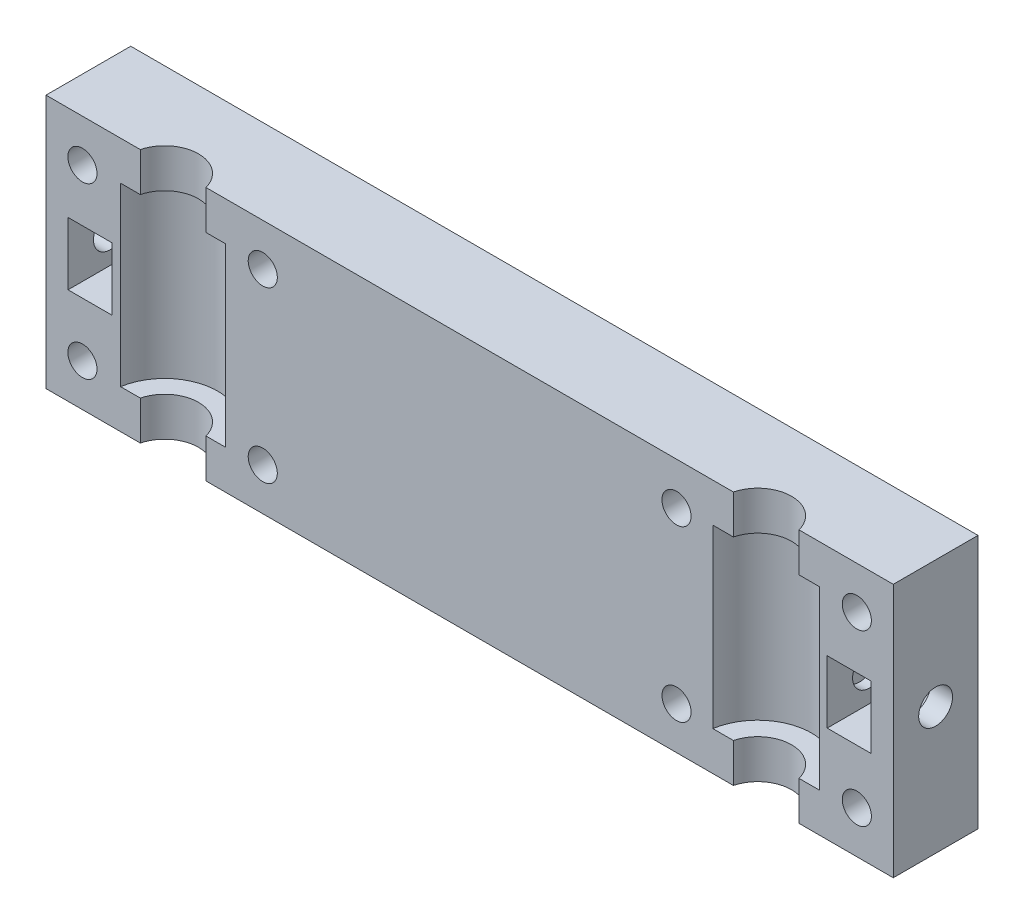
from build123d import *

# Parameters (mm, degrees)
SKETCH1_W                                      = 127
SKETCH1_H                                      = 12.7
BOSS_EXTRUDE1_DEPTH                            = 38.1
SKETCH3_R                                      = 4.445
CUT_EXTRUDE3_DEPTH                             = 2.54
CUT_EXTRUDE4_DEPTH                             = 13.208
CUT_EXTRUDE4_DEPTH_BACK                        = 13.208
SKETCH2_R                                      = 7.9756
SKETCH2_R_2                                    = 8.1026
SKETCH6_R                                      = 5.08
CUT_EXTRUDE5_DEPTH                             = 38.1
F_11_64_0_17188_DIAMETER_HOLE1_D               = 4.365752
F_11_64_0_17188_DIAMETER_HOLE1_DEPTH           = 25.4
F_11_64_0_17188_DIAMETER_HOLE1_TIP             = 1.311604225
F_11_64_0_17188_DIAMETER_HOLE1_ON_FACE_2_D     = 4.365752
F_11_64_0_17188_DIAMETER_HOLE1_ON_FACE_2_DEPTH = 25.4
F_11_64_0_17188_DIAMETER_HOLE1_ON_FACE_2_TIP   = 1.311604225
SKETCH9_R                                      = 2.54
CUT_EXTRUDE7_DEPTH                             = 11.43
SKETCH10_W                                     = 6.604
SKETCH10_H                                     = 9.398
CUT_EXTRUDE10_DEPTH                            = 76.134213245
CUT_EXTRUDE11_START                            = -11.43
SKETCH11_R                                     = 2.54
CUT_EXTRUDE11_DEPTH                            = 11.43


with BuildPart() as part:
    # Sketch1 → Boss-Extrude1 (new body)
    with BuildSketch(Plane(origin=(0, 0, 0), x_dir=(1, 0, 0), z_dir=(0, 1, 0))):
        with Locations((0, -6.35)):
            Rectangle(SKETCH1_W, SKETCH1_H)
    extrude(amount=BOSS_EXTRUDE1_DEPTH)

    # Sketch3 → Cut-Extrude3 (cut)
    with BuildSketch(Plane(origin=(0, 0, 0), x_dir=(-1, 0, 0), z_dir=(0, 0, -1))):
        with Locations((-58.039, 31.75)):
            Circle(SKETCH3_R)
        with Locations((-58.039, 6.35)):
            Circle(SKETCH3_R)
        with Locations((-31.009232106, 31.75)):
            Circle(SKETCH3_R)
        with Locations((-31.009232106, 6.35)):
            Circle(SKETCH3_R)
        with Locations((31.009232106, 31.75)):
            Circle(SKETCH3_R)
        with Locations((31.009232106, 6.35)):
            Circle(SKETCH3_R)
        with Locations((58.039, 31.75)):
            Circle(SKETCH3_R)
        with Locations((58.039, 6.35)):
            Circle(SKETCH3_R)
    extrude(amount=-CUT_EXTRUDE3_DEPTH, mode=Mode.SUBTRACT)

    # Sketch2 → Cut-Extrude4 (cut, two sides: drawn at the far end of the back side and taken through both)
    with BuildSketch(Plane(origin=(0, 19.05, 0), x_dir=(1, 0, 0), z_dir=(0, 1, 0)).offset(-CUT_EXTRUDE4_DEPTH_BACK)):
        with Locations((-44.45, -13.97)):
            Circle(SKETCH2_R)
        with Locations((44.45, -13.97)):
            Circle(SKETCH2_R_2)
    extrude(amount=CUT_EXTRUDE4_DEPTH + CUT_EXTRUDE4_DEPTH_BACK, mode=Mode.SUBTRACT)

    # Sketch6 → Cut-Extrude5 (cut)
    with BuildSketch(Plane(origin=(0, 38.1, 0), x_dir=(1, 0, 0), z_dir=(0, 1, 0))):
        with Locations((-44.45, -13.97)):
            Circle(SKETCH6_R)
        with Locations((44.45, -13.97)):
            Circle(SKETCH6_R)
    extrude(amount=-CUT_EXTRUDE5_DEPTH, mode=Mode.SUBTRACT)

    # 11/64 (0.17188) Diameter Hole1
    with Locations(Plane(origin=(58.039, 31.75, 0), x_dir=(-1, 0, 0), z_dir=(0, 0, -1))):
        with Locations((0, 0), (27.029767894, 0), (27.029767894, -25.4), (89.048232106, -25.4), (116.078, 0)):
            Hole(F_11_64_0_17188_DIAMETER_HOLE1_D / 2, depth=F_11_64_0_17188_DIAMETER_HOLE1_DEPTH)
            with Locations((0, 0, -(F_11_64_0_17188_DIAMETER_HOLE1_DEPTH + F_11_64_0_17188_DIAMETER_HOLE1_TIP / 2))):  # 118° drill point
                Cone(0, F_11_64_0_17188_DIAMETER_HOLE1_D / 2, F_11_64_0_17188_DIAMETER_HOLE1_TIP, mode=Mode.SUBTRACT)

    # 11/64 (0.17188) Diameter Hole1 on face 2
    with Locations(Plane(origin=(58.039, 6.35, 2.54), x_dir=(-1, 0, 0), z_dir=(0, 0, -1))):
        with Locations((0, 0), (89.048232106, 25.4), (116.078, 0)):
            Hole(F_11_64_0_17188_DIAMETER_HOLE1_ON_FACE_2_D / 2, depth=F_11_64_0_17188_DIAMETER_HOLE1_ON_FACE_2_DEPTH)
            with Locations((0, 0, -(F_11_64_0_17188_DIAMETER_HOLE1_ON_FACE_2_DEPTH + F_11_64_0_17188_DIAMETER_HOLE1_ON_FACE_2_TIP / 2))):  # 118° drill point
                Cone(0, F_11_64_0_17188_DIAMETER_HOLE1_ON_FACE_2_D / 2, F_11_64_0_17188_DIAMETER_HOLE1_ON_FACE_2_TIP, mode=Mode.SUBTRACT)

    # Sketch9 → Cut-Extrude7 (cut)
    with BuildSketch(Plane.ZY.offset(63.5)):
        with Locations((6.35, 19.05)):
            Circle(SKETCH9_R)
    extrude(amount=-CUT_EXTRUDE7_DEPTH, mode=Mode.SUBTRACT)

    # Sketch10 → Cut-Extrude10 (cut, through all)
    with BuildSketch(Plane.XY.offset(12.7)):
        with Locations((-56.895836127, 19.177)):
            Rectangle(SKETCH10_W, SKETCH10_H)
        with Locations((56.895836127, 19.177)):
            Rectangle(SKETCH10_W, SKETCH10_H)
    extrude(amount=-CUT_EXTRUDE10_DEPTH, mode=Mode.SUBTRACT)

    # Sketch11 → Cut-Extrude11 (cut)
    with BuildSketch(Plane(origin=(63.5, 0, 0), x_dir=(0, 0, -1), z_dir=(1, 0, 0)).offset(CUT_EXTRUDE11_START)):
        with Locations(Location((-6.35, 19.05, 0), (0, 0, 180))):
            Circle(SKETCH11_R)
    extrude(amount=CUT_EXTRUDE11_DEPTH, mode=Mode.SUBTRACT)


solid = part.part
